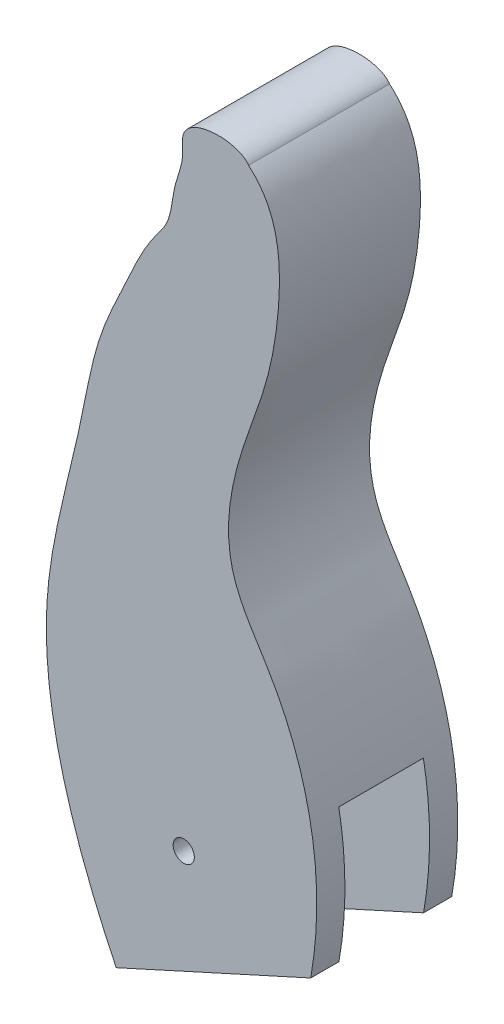
from build123d import *

# Parameters (mm, degrees)
BOSS_EXTRUDE1_DEPTH = 20
CUT_EXTRUDE1_START  = -4
CUT_EXTRUDE1_DEPTH  = 12
SKETCH3_R           = 1.5
CUT_EXTRUDE2_DEPTH  = 36


with BuildPart() as part:
    # Sketch1 → Boss-Extrude1 (new body)
    with BuildSketch(Plane.XY):
        with BuildLine():
            Line((26.037539793, -5.221993049), (-1.55167259, -17.749966223))
            add(Edge.make_bspline(
                [(17.223633693, 90.17542261), (15.791805852, 92.400110537), (7.097542115, 92.263113285), (8.182704201, 86.099268323), (6.381941402, 82.394078986), (6.368874752, 77.764974193), (2.6382655, 73.398934994), (-0.122494467, 67.030659385), (-4.54212405, 58.166445175), (-7.054408782, 42.617273449), (-15.094593854, 17.16628176), (-7.444072377, -5.584564111), (-1.55167259, -17.749966223)],
                knots=[0, 0, 0, 0, 0.082765451, 0.103118319, 0.139065356, 0.183083748, 0.210570147, 0.276498686, 0.353940752, 0.452684437, 0.662009038, 1, 1, 1, 1], degree=3))
            add(Edge.make_bspline(
                [(17.223633693, 90.17542261), (21.438913438, 86.62796581), (22.177044717, 76.534259942), (19.977584583, 64.386670786), (15.256646461, 52.863316921), (12.863248234, 39.746899676), (25.798544144, 22.512999311), (28.16136607, 6.656326695), (26.037539793, -5.221993049)],
                knots=[0, 0, 0, 0, 0.157004129, 0.27949518, 0.373492747, 0.536349496, 0.644241622, 1, 1, 1, 1], degree=3))
        make_face()
    extrude(amount=BOSS_EXTRUDE1_DEPTH)

    # Sketch2 → Cut-Extrude1 (cut)
    with BuildSketch(Plane.XY.offset(20).offset(CUT_EXTRUDE1_START)):
        Polygon((-20.664536888, 13.781629914), (39.13126716, 13.781629914), (36.377513026, -18.67332952), (-20.664536888, -20.836993483), align=None)
    extrude(amount=-CUT_EXTRUDE1_DEPTH, mode=Mode.SUBTRACT)

    # Sketch3 → Cut-Extrude2 (cut)
    with BuildSketch(Plane.XY.offset(20)):
        with Locations((8.029281637, 1.362588203)):
            Circle(SKETCH3_R)
    extrude(amount=-CUT_EXTRUDE2_DEPTH, mode=Mode.SUBTRACT)


solid = part.part
